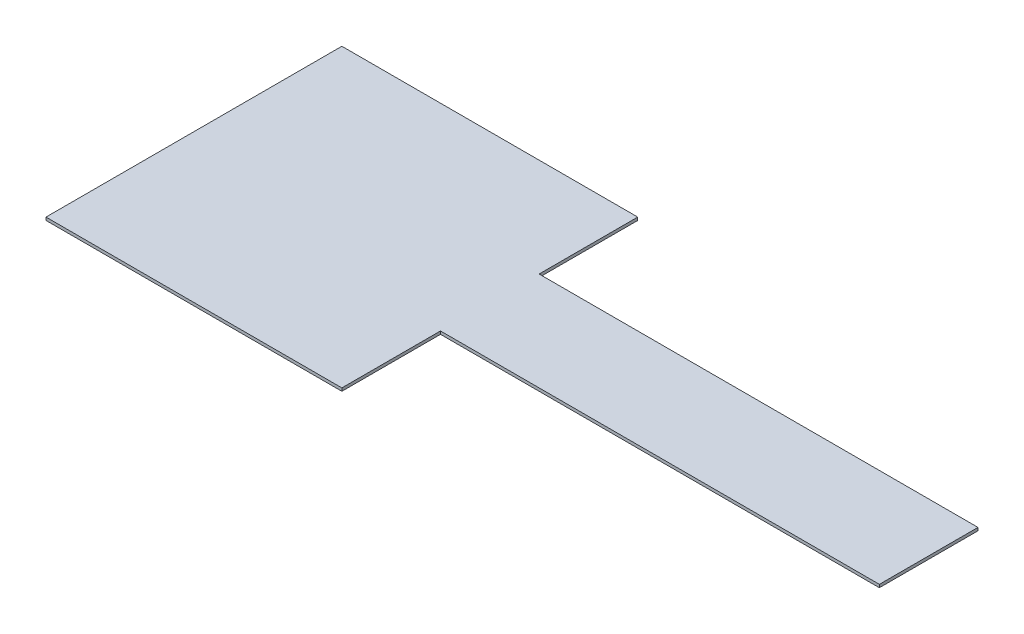
from build123d import *

# Parameters (mm, degrees)
BOSS_EXTRUDE1_DEPTH      = 0.0001
BOSS_EXTRUDE1_DEPTH_BACK = 0.3


with BuildPart() as part:
    # Sketch1 → Boss-Extrude1 (new, two sides: drawn at the far end of the back side and taken through both)
    with BuildSketch(Plane(origin=(0, 0, 0), x_dir=(1, 0, 0), z_dir=(0, 1, 0)).offset(-BOSS_EXTRUDE1_DEPTH_BACK)):
        Polygon((0, -15), (30, -15), (30, -5), (74.5, -5), (74.5, 5), (30, 5), (30, 15), (0, 15), align=None)
    extrude(amount=BOSS_EXTRUDE1_DEPTH + BOSS_EXTRUDE1_DEPTH_BACK)


solid = part.part
